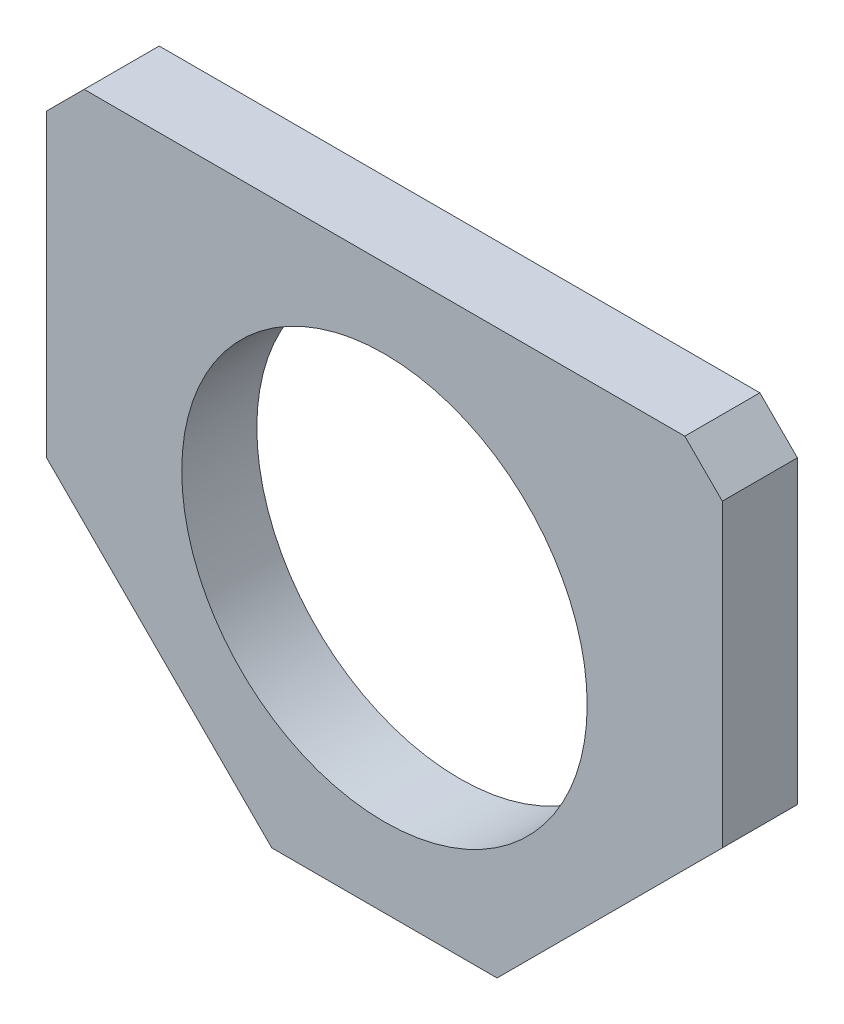
from build123d import *

# Parameters (mm, degrees)
SKETCH1_W                   = 18
SKETCH1_H                   = 15
BOSS_EXTRUDE1_DEPTH         = 2
CHAMFER1_SIZE               = 1
M12X1_25_TAPPED_HOLE1_D     = 10.8
M12X1_25_TAPPED_HOLE1_DEPTH = 8.75
M12X1_25_TAPPED_HOLE1_TIP   = 3.244647343
CHAMFER2_SIZE               = 6


with BuildPart() as part:
    # Sketch1 → Boss-Extrude1 (new body)
    with BuildSketch(Plane.XY):
        Rectangle(SKETCH1_W, SKETCH1_H)
    extrude(amount=BOSS_EXTRUDE1_DEPTH)

    # Chamfer1
    chamfer1_edges = [part.edges().sort_by_distance(p)[0] for p in [
        (-9, 7.5, 1),
        (9, 7.5, 1),
    ]]
    chamfer(chamfer1_edges, length=CHAMFER1_SIZE)

    # M12x1.25 Tapped Hole1
    with Locations(Plane.XY.offset(2)):
        with Locations((0, 0)):
            Hole(M12X1_25_TAPPED_HOLE1_D / 2, depth=M12X1_25_TAPPED_HOLE1_DEPTH)
            with Locations((0, 0, -(M12X1_25_TAPPED_HOLE1_DEPTH + M12X1_25_TAPPED_HOLE1_TIP / 2))):  # 118° drill point
                Cone(0, M12X1_25_TAPPED_HOLE1_D / 2, M12X1_25_TAPPED_HOLE1_TIP, mode=Mode.SUBTRACT)

    # Chamfer2
    chamfer2_edges = [part.edges().sort_by_distance(p)[0] for p in [
        (9, -7.5, 1),
        (-9, -7.5, 1),
    ]]
    chamfer(chamfer2_edges, length=CHAMFER2_SIZE)


solid = part.part
